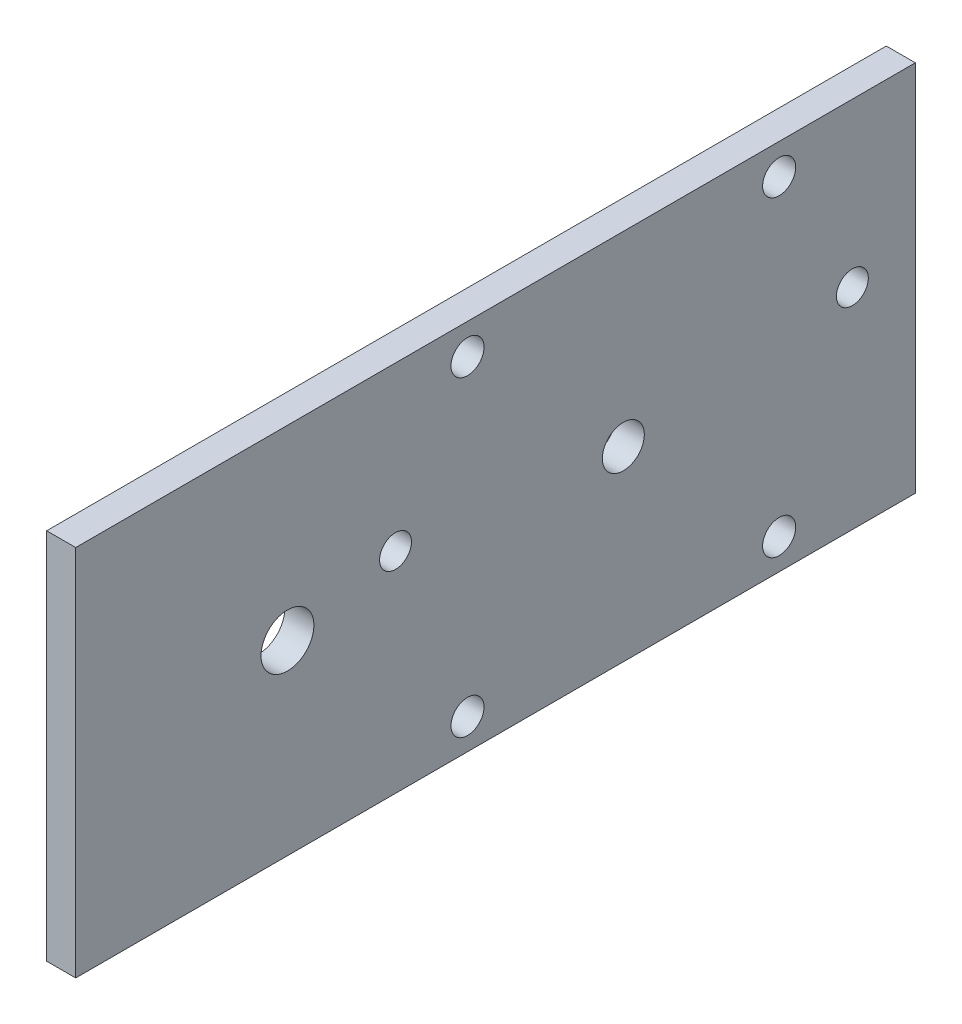
from build123d import *

# Parameters (mm, degrees)
SKETCH2_W           = 4.3942
SKETCH2_H           = 56.388
BOSS_EXTRUDE1_DEPTH = 127
SKETCH4_R           = 2.5
SKETCH4_R_2         = 2.413
SKETCH4_R_3         = 3.175
SKETCH4_R_4         = 4
CUT_EXTRUDE2_DEPTH  = 140.024873809


with BuildPart() as part:
    # Sketch2 → Boss-Extrude1 (new body)
    with BuildSketch(Plane.XY):
        with Locations((2.1971, 28.194)):
            Rectangle(SKETCH2_W, SKETCH2_H)
    extrude(amount=BOSS_EXTRUDE1_DEPTH)

    # Sketch4 → Cut-Extrude2 (cut, through all)
    with BuildSketch(Plane.ZY):
        with Locations((20.5994, 4.629999884)):
            Circle(SKETCH4_R)
        with Locations((9.525, 31.75)):
            Circle(SKETCH4_R_2)
        with Locations((67.7394, 4.629999884)):
            Circle(SKETCH4_R)
        with Locations((78.625, 31.75)):
            Circle(SKETCH4_R_2)
        with Locations((44.1706, 28.199999884)):
            Circle(SKETCH4_R_3)
        with Locations((94.9706, 28.199999884)):
            Circle(SKETCH4_R_4)
        with Locations((67.7394, 51.772399884)):
            Circle(SKETCH4_R)
        with Locations((20.5994, 51.772399884)):
            Circle(SKETCH4_R)
    extrude(amount=-CUT_EXTRUDE2_DEPTH, mode=Mode.SUBTRACT)


solid = part.part
